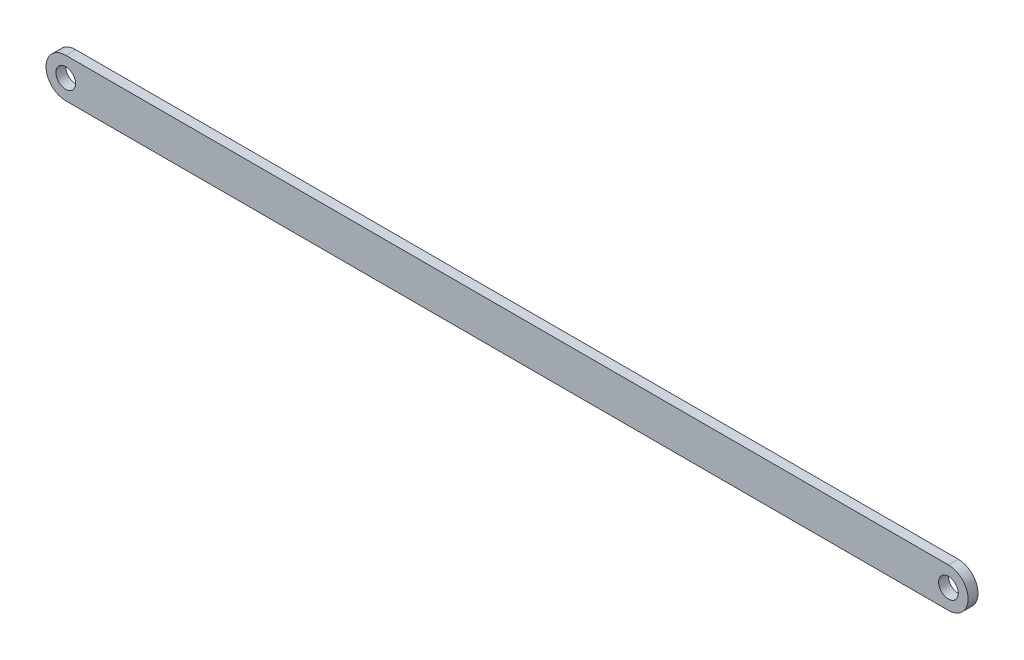
from build123d import *

# Parameters (mm, degrees)
ESBO_O1_R                = 1
RESSALTO_EXTRUS_O1_DEPTH = 1


with BuildPart() as part:
    # Esboço1 → Ressalto-extrusão1 (new body)
    with BuildSketch(Plane.XY):
        with BuildLine():
            Line((-44.785, 2), (44.785, 2))
            ThreePointArc((44.785, 2), (46.785, 0), (44.785, -2))
            Line((44.785, -2), (-44.785, -2))
            ThreePointArc((-44.785, -2), (-46.785, 0), (-44.785, 2))
        make_face()
        with Locations((-44.785, 0)):
            Circle(ESBO_O1_R, mode=Mode.SUBTRACT)
        with Locations((44.785, 0)):
            Circle(ESBO_O1_R, mode=Mode.SUBTRACT)
    extrude(amount=RESSALTO_EXTRUS_O1_DEPTH)


solid = part.part
